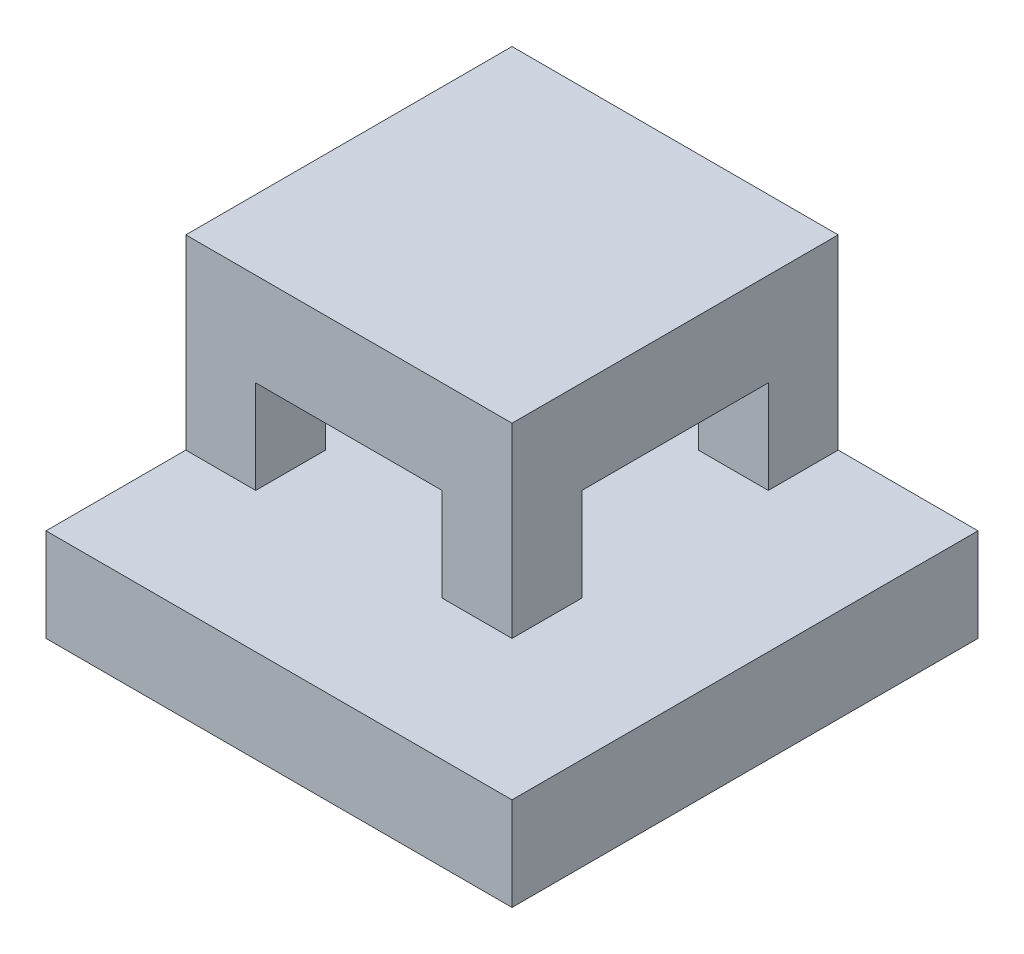
from build123d import *

# Parameters (mm, degrees)
CROQUIS1_W              = 100
CROQUIS1_H              = 100
SALIENTE_EXTRUIR1_DEPTH = 20
CROQUIS2_W              = 15
CROQUIS2_H              = 15
SALIENTE_EXTRUIR2_DEPTH = 20
CROQUIS3_W              = 70
CROQUIS3_H              = 70
SALIENTE_EXTRUIR3_DEPTH = 20


with BuildPart() as part:
    # Croquis1 → Saliente-Extruir1 (new body)
    with BuildSketch(Plane(origin=(0, 0, 0), x_dir=(1, 0, 0), z_dir=(0, 1, 0))):
        Rectangle(CROQUIS1_W, CROQUIS1_H)
    extrude(amount=SALIENTE_EXTRUIR1_DEPTH)

    # Croquis2 → Saliente-Extruir2 (add)
    with BuildSketch(Plane(origin=(0, 20, 0), x_dir=(1, 0, 0), z_dir=(0, 1, 0))):
        with Locations((-42.5, -12.5)):
            Rectangle(CROQUIS2_W, CROQUIS2_H)
        with Locations((-42.5, 42.5)):
            Rectangle(CROQUIS2_W, CROQUIS2_H)
        with Locations((12.5, 42.5)):
            Rectangle(CROQUIS2_W, CROQUIS2_H)
        with Locations((12.5, -12.5)):
            Rectangle(CROQUIS2_W, CROQUIS2_H)
    extrude(amount=SALIENTE_EXTRUIR2_DEPTH)

    # Croquis3 → Saliente-Extruir3 (add)
    with BuildSketch(Plane(origin=(0, 40, 0), x_dir=(1, 0, 0), z_dir=(0, 1, 0))):
        with Locations((-15, 15)):
            Rectangle(CROQUIS3_W, CROQUIS3_H)
    extrude(amount=SALIENTE_EXTRUIR3_DEPTH)


solid = part.part
